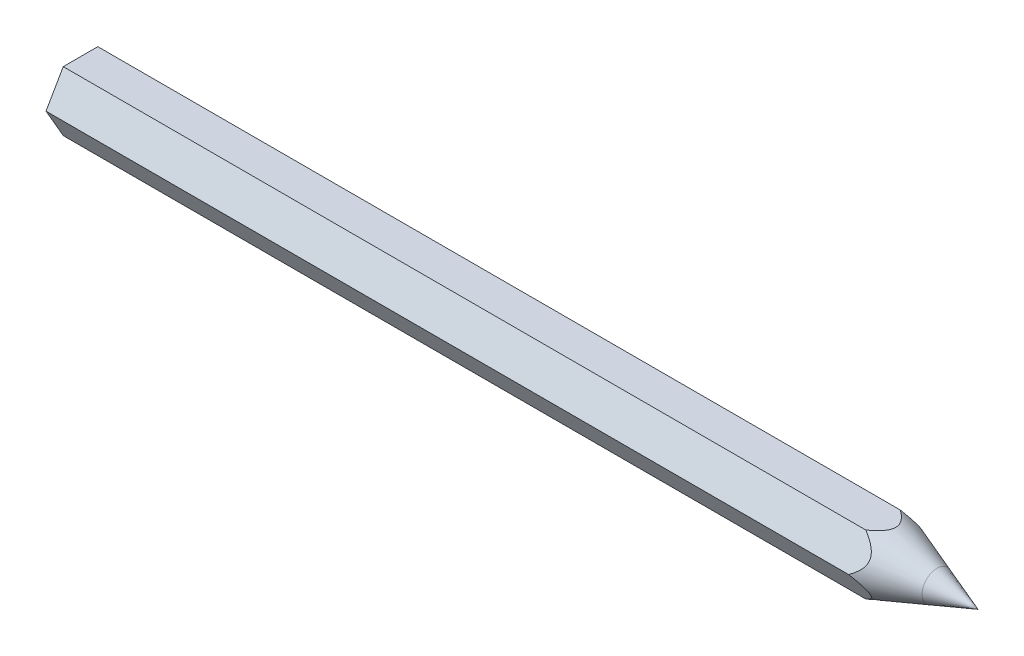
from build123d import *

# Parameters (mm, degrees)
SKETCH1_R           = 2.5
BOSS_EXTRUDE1_DEPTH = 150
SKETCH2_R           = 2.5
BOSS_EXTRUDE2_DEPTH = 150


with BuildPart() as part:
    # Sketch1 → Boss-Extrude1 (new body)
    with BuildSketch(Plane.YZ):
        Polygon((5.002510393, -2.882398845), (4.99748582, 2.89110166), (-0.005024572, 5.773500505), (-5.002510393, 2.882398845), (-4.99748582, -2.89110166), (0.005024572, -5.773500505), align=None)
        with Locations(Location((0, 0, 0), (0, 0, 270))):
            Circle(SKETCH1_R, mode=Mode.SUBTRACT)
    extrude(amount=BOSS_EXTRUDE1_DEPTH)


with BuildPart() as body_2:
    # Sketch2 → Boss-Extrude2 (new body)
    with BuildSketch(Plane.YZ):
        with Locations(Location((0, 0, 0), (0, 0, 270))):
            Circle(SKETCH2_R)
    extrude(amount=BOSS_EXTRUDE2_DEPTH)


with BuildPart() as cut_revolve1_tool:
    # Sketch3 → Cut-Revolve1 (revolve)
    with BuildSketch(Plane(origin=(0, 0, 0), x_dir=(-1, 0, 0), z_dir=(0, 1, 0))):
        Polygon((-150, 0.004351407), (-134.149393124, 5.773500505), (-134.149393124, 15.773500505), (-160, 15.773500505), (-160, 0.004351407), align=None)
    revolve(axis=Axis((160, 0, 0.004351407), (-1, 0, 0)))


with BuildPart() as part_1:
    add(part.part)

    # Cut-Revolve1: cut by cut_revolve1_tool
    add(cut_revolve1_tool.part, mode=Mode.SUBTRACT)


with BuildPart() as body_2_1:
    add(body_2.part)

    # Cut-Revolve1: cut by cut_revolve1_tool
    add(cut_revolve1_tool.part, mode=Mode.SUBTRACT)


solid = Compound([part_1.part, body_2_1.part])
